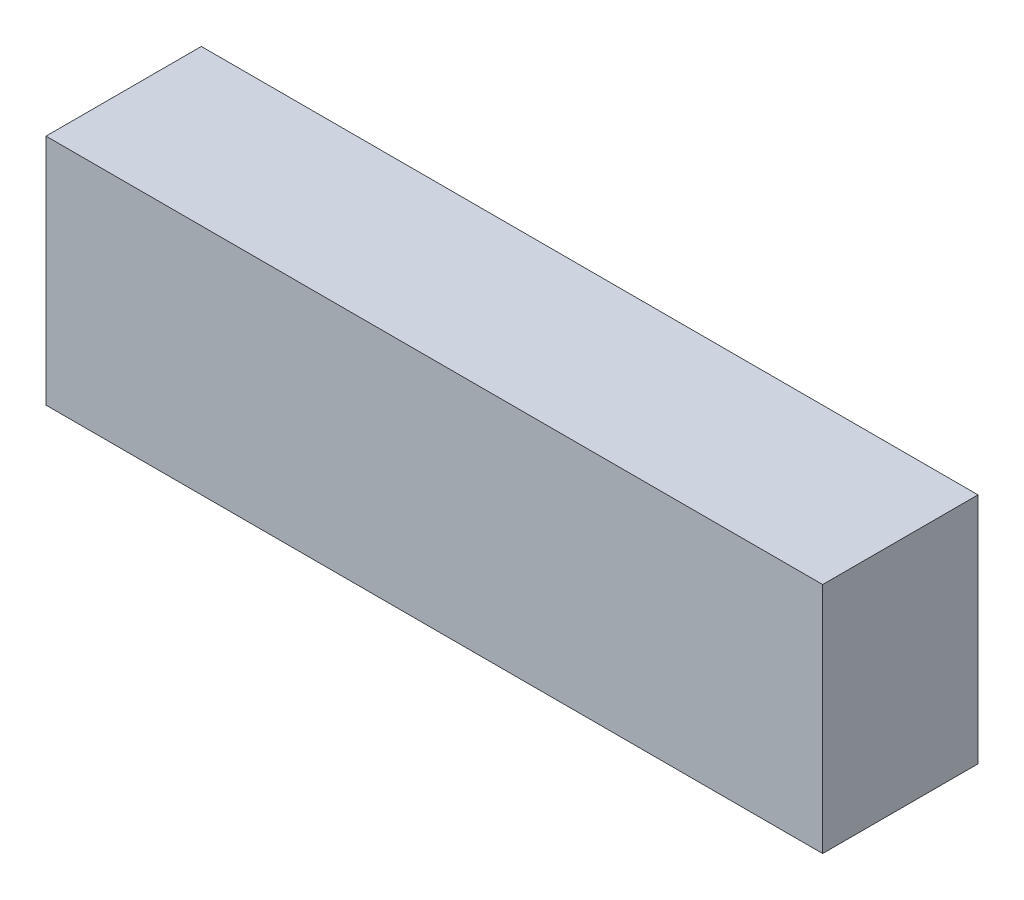
from build123d import *

# Parameters (mm, degrees)
SKETCH1_W           = 100
SKETCH1_H           = 30
BOSS_EXTRUDE1_DEPTH = 20


with BuildPart() as part:
    # Sketch1 → Boss-Extrude1 (new body)
    with BuildSketch(Plane.XY):
        Rectangle(SKETCH1_W, SKETCH1_H)
    extrude(amount=BOSS_EXTRUDE1_DEPTH)


solid = part.part
